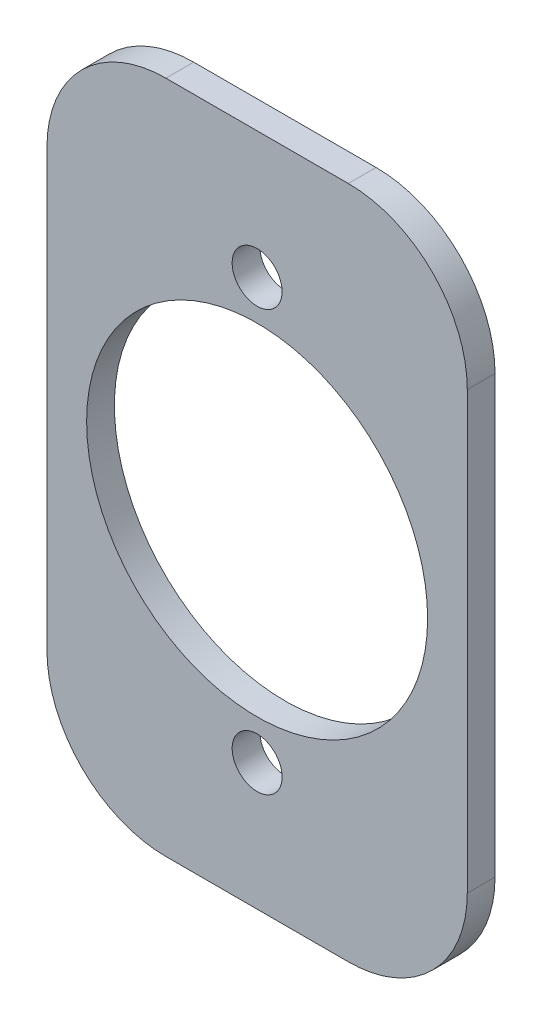
from build123d import *

# Parameters (mm, degrees)
BOSS_EXTRUDE1_DEPTH = 5
SKETCH4_W           = 53
SKETCH4_H           = 85
BOSS_EXTRUDE2_DEPTH = 3.5
SKETCH2_R           = 21.5
CUT_EXTRUDE1_DEPTH  = 74.391075752
SKETCH3_R           = 3.15
CUT_EXTRUDE2_DEPTH  = 74.391075752
SKETCH16_W          = 82.074163125
SKETCH16_H          = 140.053159095
SKETCH16_W_2        = 53
SKETCH16_H_2        = 85
LAZY_CUT_DEPTH      = 74.068461049
FILLET1_R           = 15
SKETCH17_W          = 53
SKETCH17_H          = 5
CUT_EXTRUDE7_DEPTH  = 90.175388981
SKETCH12_R          = 2.9
CUT_EXTRUDE3_DEPTH  = 3
SKETCH13_R          = 1.75
CUT_EXTRUDE4_DEPTH  = 51.386009963
CUT_EXTRUDE5_DEPTH  = 3
CUT_EXTRUDE6_DEPTH  = 1.5


with BuildPart() as part:
    # Sketch1 → Boss-Extrude1 (new body)
    with BuildSketch(Plane.XY):
        with BuildLine():
            Line((25, 65), (-25, 65))
            ThreePointArc((-25, 65), (-30.656854249, 62.656854249), (-33, 57))
            Line((-33, 57), (-33, -57))
            ThreePointArc((-33, -57), (-30.656854249, -62.656854249), (-25, -65))
            Line((-25, -65), (25, -65))
            ThreePointArc((25, -65), (30.656854249, -62.656854249), (33, -57))
            Line((33, -57), (33, 57))
            ThreePointArc((33, 57), (30.656854249, 62.656854249), (25, 65))
        make_face()
    extrude(amount=BOSS_EXTRUDE1_DEPTH)

    # Sketch4 → Boss-Extrude2 (add)
    with BuildSketch(Plane(origin=(0, 0, 0), x_dir=(-1, 0, 0), z_dir=(0, 0, -1))):
        Rectangle(SKETCH4_W, SKETCH4_H)
    extrude(amount=BOSS_EXTRUDE2_DEPTH)

    # Sketch2 → Cut-Extrude1 (cut, through all)
    with BuildSketch(Plane.XY.offset(5)):
        Circle(SKETCH2_R)
    extrude(amount=-CUT_EXTRUDE1_DEPTH, mode=Mode.SUBTRACT)

    # Sketch3 → Cut-Extrude2 (cut, through all)
    with BuildSketch(Plane.XY.offset(5)):
        with Locations((0, 26.5)):
            Circle(SKETCH3_R)
        with Locations((0, -26.5)):
            Circle(SKETCH3_R)
    extrude(amount=-CUT_EXTRUDE2_DEPTH, mode=Mode.SUBTRACT)

    # Sketch16 → lazy cut (cut, through all)
    with BuildSketch(Plane(origin=(0, 0, 0), x_dir=(-1, 0, 0), z_dir=(0, 0, -1))):
        with Locations((0.978866165, -0.150594795)):
            Rectangle(SKETCH16_W, SKETCH16_H)
        Rectangle(SKETCH16_W_2, SKETCH16_H_2, mode=Mode.SUBTRACT)
    extrude(amount=-LAZY_CUT_DEPTH, mode=Mode.SUBTRACT)

    # Fillet1
    fillet1_edges = [part.edges().sort_by_distance(p)[0] for p in [
        (-26.5, -42.5, 0.75),
        (-26.5, 42.5, 0.75),
        (26.5, 42.5, 0.75),
        (26.5, -42.5, 0.75),
    ]]
    fillet(fillet1_edges, radius=FILLET1_R)

    # Sketch17 → Cut-Extrude7 (cut, through all)
    with BuildSketch(Plane(origin=(0, 42.5, 0), x_dir=(1, 0, 0), z_dir=(0, 1, 0))):
        with Locations((0, -2.5)):
            Rectangle(SKETCH17_W, SKETCH17_H)
    extrude(amount=-CUT_EXTRUDE7_DEPTH, mode=Mode.SUBTRACT)

    # Sketch12 → Cut-Extrude3 (cut)
    with BuildSketch(Plane.XY.offset(5)):
        with Locations((-27.75, 59.75)):
            Circle(SKETCH12_R)
        with Locations((27.75, 59.75)):
            Circle(SKETCH12_R)
        with Locations((-27.75, -59.75)):
            Circle(SKETCH12_R)
        with Locations((27.75, -59.75)):
            Circle(SKETCH12_R)
    extrude(amount=-CUT_EXTRUDE3_DEPTH, mode=Mode.SUBTRACT)

    # Sketch13 → Cut-Extrude4 (cut, through all)
    with BuildSketch(Plane.XY.offset(2)):
        with Locations((-27.75, 59.75)):
            Circle(SKETCH13_R)
        with Locations((27.75, 59.75)):
            Circle(SKETCH13_R)
        with Locations((27.75, -59.75)):
            Circle(SKETCH13_R)
        with Locations((-27.75, -59.75)):
            Circle(SKETCH13_R)
    extrude(amount=-CUT_EXTRUDE4_DEPTH, mode=Mode.SUBTRACT)

    # Sketch14 → Cut-Extrude5 (cut)
    with BuildSketch(Plane.XY.offset(5)):
        with BuildLine():
            Line((-5.5, 26.5), (-5.5, -26.5))
            ThreePointArc((-5.5, -26.5), (0, -32), (5.5, -26.5))
            Line((5.5, -26.5), (5.5, 26.5))
            ThreePointArc((5.5, 26.5), (0, 32), (-5.5, 26.5))
        make_face()
    extrude(amount=-CUT_EXTRUDE5_DEPTH, mode=Mode.SUBTRACT)

    # Sketch15 → Cut-Extrude6 (cut)
    with BuildSketch(Plane.XY.offset(5)):
        with BuildLine():
            Line((-2.5, 65), (-2.5, 31.398979486))
            ThreePointArc((-2.5, 31.398979486), (0, 32), (2.5, 31.398979486))
            Line((2.5, 31.398979486), (2.5, 65))
            Line((2.5, 65), (-2.5, 65))
        make_face()
        with BuildLine():
            Line((-27.75, 13.75), (-20.879116361, 13.75))
            ThreePointArc((-20.879116361, 13.75), (-14.747047157, 20.187238547), (-6.75, 24.071508054))
            Line((-6.75, 24.071508054), (-6.75, 59.75))
            Line((-6.75, 59.75), (-21.75, 59.75))
            ThreePointArc((-21.75, 59.75), (-23.507359313, 55.507359313), (-27.75, 53.75))
            Line((-27.75, 53.75), (-27.75, 13.75))
        make_face()
        with BuildLine():
            Line((27.75, 13.75), (20.879116361, 13.75))
            ThreePointArc((20.879116361, 13.75), (14.747047157, 20.187238547), (6.75, 24.071508054))
            Line((6.75, 24.071508054), (6.75, 59.75))
            Line((6.75, 59.75), (21.75, 59.75))
            ThreePointArc((21.75, 59.75), (23.507359313, 55.507359313), (27.75, 53.75))
            Line((27.75, 53.75), (27.75, 13.75))
        make_face()
        with BuildLine():
            Line((27.75, -53.75), (27.75, -13.75))
            Line((27.75, -13.75), (20.879116361, -13.75))
            ThreePointArc((20.879116361, -13.75), (14.747047157, -20.187238547), (6.75, -24.071508054))
            Line((6.75, -24.071508054), (6.75, -59.75))
            Line((6.75, -59.75), (21.75, -59.75))
            ThreePointArc((21.75, -59.75), (23.507359313, -55.507359313), (27.75, -53.75))
        make_face()
        with BuildLine():
            Line((2.5, -65), (2.5, -31.398979486))
            ThreePointArc((2.5, -31.398979486), (0, -32), (-2.5, -31.398979486))
            Line((-2.5, -31.398979486), (-2.5, -65))
            Line((-2.5, -65), (2.5, -65))
        make_face()
        with BuildLine():
            Line((-6.75, -59.75), (-6.75, -24.071508054))
            ThreePointArc((-6.75, -24.071508054), (-14.747047157, -20.187238547), (-20.879116361, -13.75))
            Line((-20.879116361, -13.75), (-27.75, -13.75))
            Line((-27.75, -13.75), (-27.75, -53.75))
            ThreePointArc((-27.75, -53.75), (-23.507359313, -55.507359313), (-21.75, -59.75))
            Line((-21.75, -59.75), (-6.75, -59.75))
        make_face()
    extrude(amount=-CUT_EXTRUDE6_DEPTH, mode=Mode.SUBTRACT)


solid = part.part
